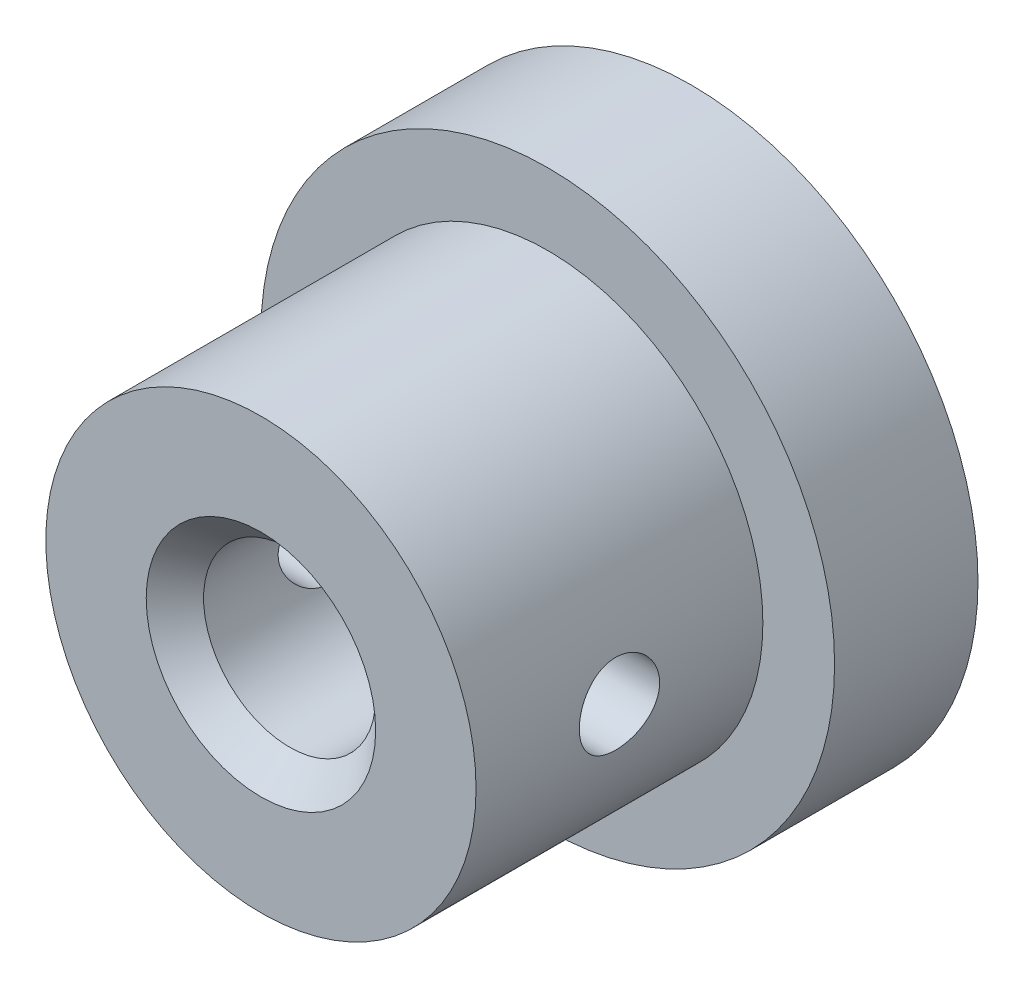
from build123d import *

# Parameters (mm, degrees)
SKETCH_1_R          = 7.5
SKETCH_1_R_2        = 3
EXTRUDE_1_DEPTH     = 15
SKETCH_1_3_R        = 10
SKETCH_1_3_R_2      = 7.5
EXTRUDE_2_DEPTH     = 5
SKETCH_2_R          = 1.4
CUT_EXTRUDE_1_DEPTH = 22.5
CHAMFER_1_SIZE      = 1


with BuildPart() as part:
    # 스케치1 → 보스-돌출1 (new body)
    with BuildSketch(Plane.XY):
        Circle(SKETCH_1_R)
        Circle(SKETCH_1_R_2, mode=Mode.SUBTRACT)
    extrude(amount=EXTRUDE_1_DEPTH)

    # 스케치1<3> → 보스-돌출2 (add)
    with BuildSketch(Plane.XY):
        Circle(SKETCH_1_3_R)
        Circle(SKETCH_1_3_R_2, mode=Mode.SUBTRACT)
    extrude(amount=EXTRUDE_2_DEPTH)

    # 스케치2 → 컷-돌출1 (cut, symmetric)
    with BuildSketch(Plane(origin=(0, 0, 0), x_dir=(0, 0, -1), z_dir=(1, 0, 0))):
        with Locations((-10, 0)):
            Circle(SKETCH_2_R)
    extrude(amount=CUT_EXTRUDE_1_DEPTH, both=True, mode=Mode.SUBTRACT)

    # 모따기1
    chamfer_1_edges = [part.edges().sort_by_distance(p)[0] for p in [
        (-3, 0, 15),
        (-3, 0, 0),
    ]]
    chamfer(chamfer_1_edges, length=CHAMFER_1_SIZE)


solid = part.part
